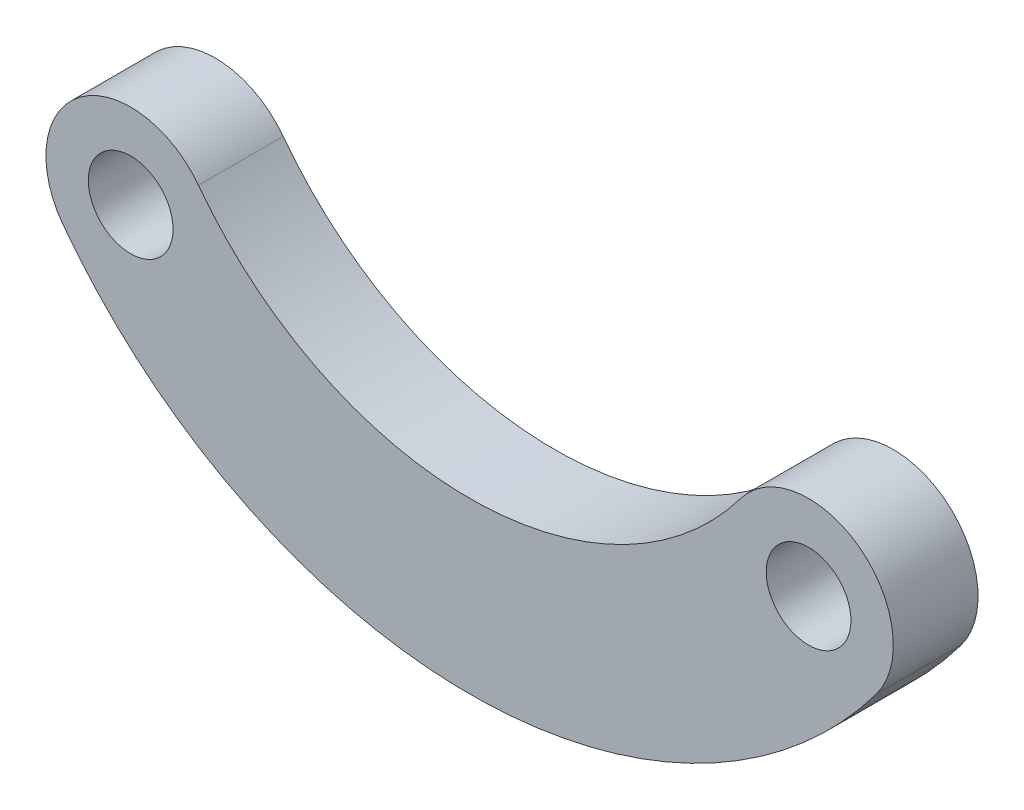
from build123d import *

# Parameters (mm, degrees)
SKETCH1_R           = 1.27
BOSS_EXTRUDE1_DEPTH = 2.54


with BuildPart() as part:
    # Sketch1 → Boss-Extrude1 (new body)
    with BuildSketch(Plane.XY):
        with BuildLine():
            ThreePointArc((-2.032, -1.524), (10.16, -7.62), (22.352, -1.524))
            ThreePointArc((22.352, -1.524), (21.844, 2.032), (18.288, 1.524))
            ThreePointArc((18.288, 1.524), (10.16, -2.54), (2.032, 1.524))
            ThreePointArc((2.032, 1.524), (-1.524, 2.032), (-2.032, -1.524))
        make_face()
        Circle(SKETCH1_R, mode=Mode.SUBTRACT)
        with Locations((20.32, 0)):
            Circle(SKETCH1_R, mode=Mode.SUBTRACT)
    extrude(amount=BOSS_EXTRUDE1_DEPTH)


solid = part.part
